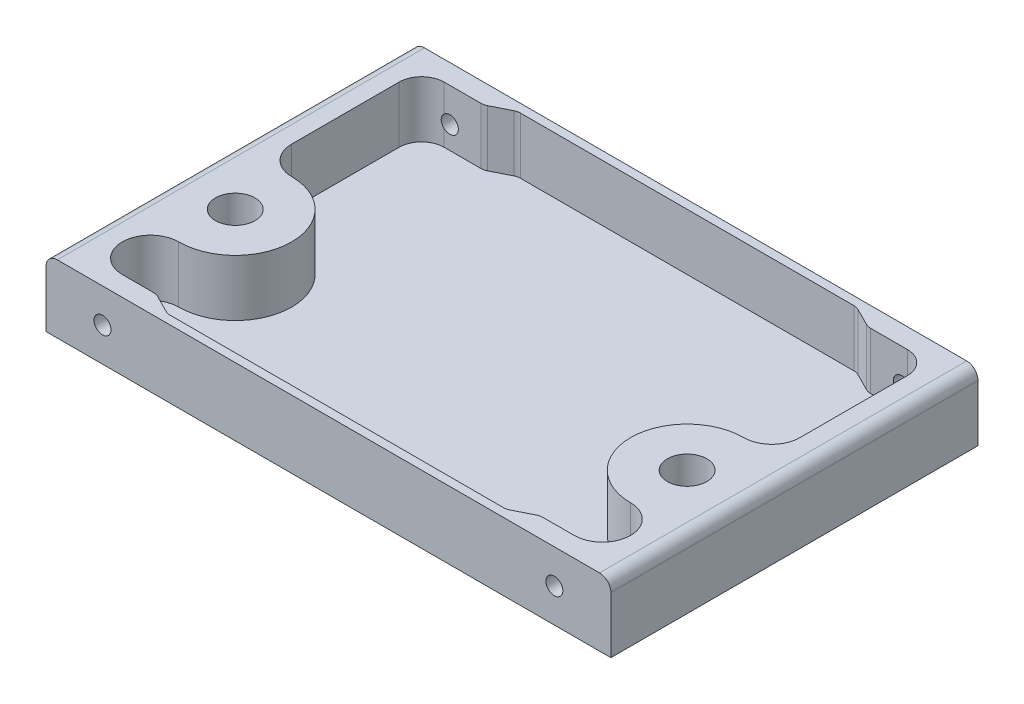
from build123d import *

# Parameters (mm, degrees)
SKETCH_1_W          = 100
SKETCH_1_H          = 65
EXTRUDE_1_DEPTH     = 12
SKETCH_2_R          = 3.5
CUT_EXTRUDE_2_DEPTH = 10
SKETCH_3_R          = 3.5
CUT_EXTRUDE_3_DEPTH = 61.466933112
SKETCH_4_R          = 3.5
CUT_EXTRUDE_4_DEPTH = 61.466933112
CUT_EXTRUDE_5_REACH = 84.879
SKETCH_5_R          = 1.5
CUT_EXTRUDE_6_REACH = 84.879
SKETCH_6_R          = 1.5
FILLET_3_R          = 2


with BuildPart() as part:
    # 草图1 → 凸台-拉伸1 (new body)
    with BuildSketch(Plane(origin=(0, 0, 0), x_dir=(1, 0, 0), z_dir=(0, 1, 0))):
        Rectangle(SKETCH_1_W, SKETCH_1_H)
    extrude(amount=EXTRUDE_1_DEPTH)

    # 草图2 → 切除-拉伸2 (cut)
    with BuildSketch(Plane(origin=(0, 12, 0), x_dir=(1, 0, 0), z_dir=(0, 1, 0))):
        with Locations(Location((-40, -9, 0), (0, 0, 270))):
            Circle(SKETCH_2_R)
        with Locations(Location((40, -9, 0), (0, 0, 90))):
            Circle(SKETCH_2_R)
        with BuildLine():
            Line((-30.422291236, 30.788854382), (-33.577708764, 29.211145618))
            ThreePointArc((-33.577708764, 29.211145618), (-34.012630114, 29.053502021), (-34.472135955, 29))
            Line((-34.472135955, 29), (-41, 29))
            ThreePointArc((-41, 29), (-43.828427125, 27.828427125), (-45, 25))
            Line((-45, 25), (-45, 6))
            ThreePointArc((-45, 6), (-43.535533906, 2.464466094), (-40, 1))
            ThreePointArc((-40, 1), (-30, -9), (-40, -19))
            ThreePointArc((-40, -19), (-45, -24), (-40, -29))
            Line((-40, -29), (-34.439229319, -29))
            ThreePointArc((-34.439229319, -29), (-33.976113717, -29.054357705), (-33.538172016, -29.214476061))
            Line((-33.538172016, -29.214476061), (-30.425003094, -30.785523939))
            ThreePointArc((-30.425003094, -30.785523939), (-29.987061393, -30.945642295), (-29.52394579, -31))
            Line((-29.52394579, -31), (29.52394579, -31))
            ThreePointArc((29.52394579, -31), (29.987061393, -30.945642295), (30.425003094, -30.785523939))
            Line((30.425003094, -30.785523939), (33.538172016, -29.214476061))
            ThreePointArc((33.538172016, -29.214476061), (33.976113717, -29.054357705), (34.439229319, -29))
            Line((34.439229319, -29), (40, -29))
            ThreePointArc((40, -29), (45, -24), (40, -19))
            ThreePointArc((40, -19), (30, -9), (40, 1))
            ThreePointArc((40, 1), (43.535533906, 2.464466094), (45, 6))
            Line((45, 6), (45, 25))
            ThreePointArc((45, 25), (43.828427125, 27.828427125), (41, 29))
            Line((41, 29), (34.472135955, 29))
            ThreePointArc((34.472135955, 29), (34.012630114, 29.053502021), (33.577708764, 29.211145618))
            Line((33.577708764, 29.211145618), (30.422291236, 30.788854382))
            ThreePointArc((30.422291236, 30.788854382), (29.987369886, 30.946497979), (29.527864045, 31))
            Line((29.527864045, 31), (-29.527864045, 31))
            ThreePointArc((-29.527864045, 31), (-29.987369886, 30.946497979), (-30.422291236, 30.788854382))
        make_face()
    extrude(amount=-CUT_EXTRUDE_2_DEPTH, mode=Mode.SUBTRACT)

    # 草图3 → 切除-拉伸3 (cut, through all)
    with BuildSketch(Plane(origin=(0, 2, 0), x_dir=(1, 0, 0), z_dir=(0, 1, 0))):
        with Locations(Location((-40, -9, 0), (0, 0, 270))):
            Circle(SKETCH_3_R)
    extrude(amount=-CUT_EXTRUDE_3_DEPTH, mode=Mode.SUBTRACT)

    # 草图4 → 切除-拉伸4 (cut, through all)
    with BuildSketch(Plane(origin=(0, 2, 0), x_dir=(1, 0, 0), z_dir=(0, 1, 0))):
        with Locations(Location((40, -9, 0), (0, 0, 270))):
            Circle(SKETCH_4_R)
    extrude(amount=-CUT_EXTRUDE_4_DEPTH, mode=Mode.SUBTRACT)

    # 草图5 → 切除-拉伸5 (cut, up to next)
    with BuildSketch(Plane.XY.offset(32.5), mode=Mode.PRIVATE) as cut_extrude_5_sk1:
        with Locations((-40, 6)):
            Circle(SKETCH_5_R)
    cut_extrude_5_tool1 = extrude(cut_extrude_5_sk1.sketch, amount=-CUT_EXTRUDE_5_REACH, mode=Mode.PRIVATE) & part.part
    # 草图5 → 切除-拉伸5 (cut, up to next)
    with BuildSketch(Plane.XY.offset(32.5), mode=Mode.PRIVATE) as cut_extrude_5_sk2:
        with Locations((40, 6)):
            Circle(SKETCH_5_R)
    cut_extrude_5_tool2 = extrude(cut_extrude_5_sk2.sketch, amount=-CUT_EXTRUDE_5_REACH, mode=Mode.PRIVATE) & part.part
    add(cut_extrude_5_tool1.solids().sort_by_distance((-40, 6, 32.5))[0], mode=Mode.SUBTRACT)
    add(cut_extrude_5_tool2.solids().sort_by_distance((40, 6, 32.5))[0], mode=Mode.SUBTRACT)

    # 草图6 → 切除-拉伸6 (cut, up to next)
    with BuildSketch(Plane(origin=(0, 0, -32.5), x_dir=(-1, 0, 0), z_dir=(0, 0, -1)), mode=Mode.PRIVATE) as cut_extrude_6_sk1:
        with Locations(Location((-40, 6, 0), (0, 0, 180))):
            Circle(SKETCH_6_R)
    cut_extrude_6_tool1 = extrude(cut_extrude_6_sk1.sketch, amount=-CUT_EXTRUDE_6_REACH, mode=Mode.PRIVATE) & part.part
    # 草图6 → 切除-拉伸6 (cut, up to next)
    with BuildSketch(Plane(origin=(0, 0, -32.5), x_dir=(-1, 0, 0), z_dir=(0, 0, -1)), mode=Mode.PRIVATE) as cut_extrude_6_sk2:
        with Locations(Location((40, 6, 0), (0, 0, 180))):
            Circle(SKETCH_6_R)
    cut_extrude_6_tool2 = extrude(cut_extrude_6_sk2.sketch, amount=-CUT_EXTRUDE_6_REACH, mode=Mode.PRIVATE) & part.part
    add(cut_extrude_6_tool1.solids().sort_by_distance((40, 6, -32.5))[0], mode=Mode.SUBTRACT)
    add(cut_extrude_6_tool2.solids().sort_by_distance((-40, 6, -32.5))[0], mode=Mode.SUBTRACT)

    # 圆角3
    fillet_3_edges = [part.edges().sort_by_distance(p)[0] for p in [
        (-50, 12, 0),
        (50, 12, 0),
    ]]
    fillet(fillet_3_edges, radius=FILLET_3_R)


solid = part.part
